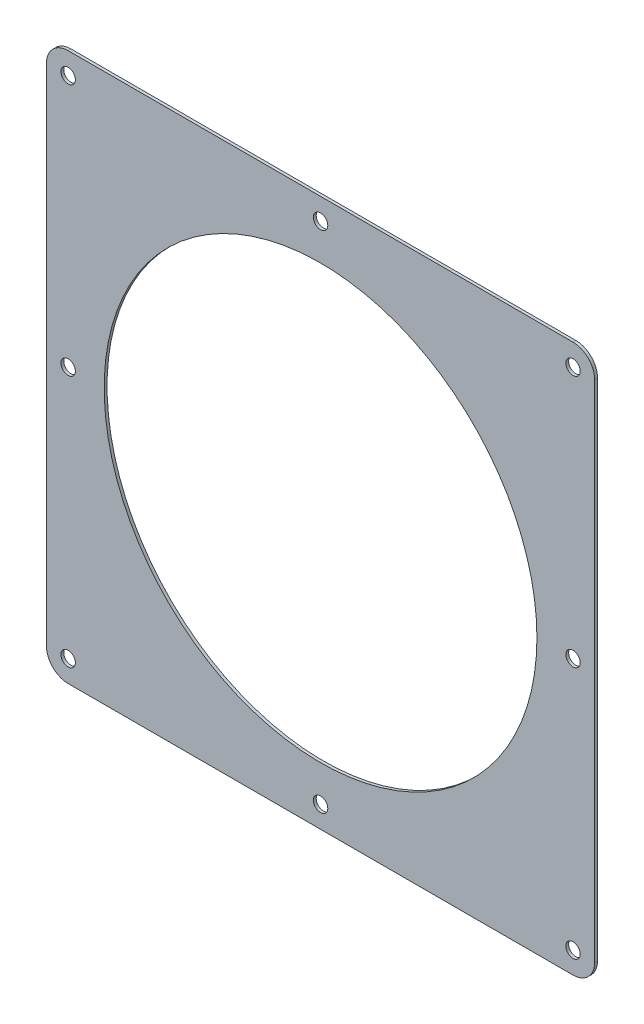
from build123d import *

# Parameters (mm, degrees)
SKETCH2_R           = 5
SKETCH2_R_2         = 150
BOSS_EXTRUDE1_DEPTH = 2


with BuildPart() as part:
    # Sketch2 → Boss-Extrude1 (new body)
    with BuildSketch(Plane.XY):
        with BuildLine():
            Line((-175, 190), (175, 190))
            ThreePointArc((175, 190), (185.606601718, 185.606601718), (190, 175))
            Line((190, 175), (190, -175))
            ThreePointArc((190, -175), (185.606601718, -185.606601718), (175, -190))
            Line((175, -190), (-175, -190))
            ThreePointArc((-175, -190), (-185.606601718, -185.606601718), (-190, -175))
            Line((-190, -175), (-190, 175))
            ThreePointArc((-190, 175), (-185.606601718, 185.606601718), (-175, 190))
        make_face()
        with Locations((-175, 175)):
            Circle(SKETCH2_R, mode=Mode.SUBTRACT)
        with Locations((0, 175)):
            Circle(SKETCH2_R, mode=Mode.SUBTRACT)
        with Locations((175, 175)):
            Circle(SKETCH2_R, mode=Mode.SUBTRACT)
        with Locations((175, 0)):
            Circle(SKETCH2_R, mode=Mode.SUBTRACT)
        with Locations((-175, 0)):
            Circle(SKETCH2_R, mode=Mode.SUBTRACT)
        with Locations((-175, -175)):
            Circle(SKETCH2_R, mode=Mode.SUBTRACT)
        with Locations((0, -175)):
            Circle(SKETCH2_R, mode=Mode.SUBTRACT)
        with Locations((175, -175)):
            Circle(SKETCH2_R, mode=Mode.SUBTRACT)
        Circle(SKETCH2_R_2, mode=Mode.SUBTRACT)
    extrude(amount=BOSS_EXTRUDE1_DEPTH)


solid = part.part
